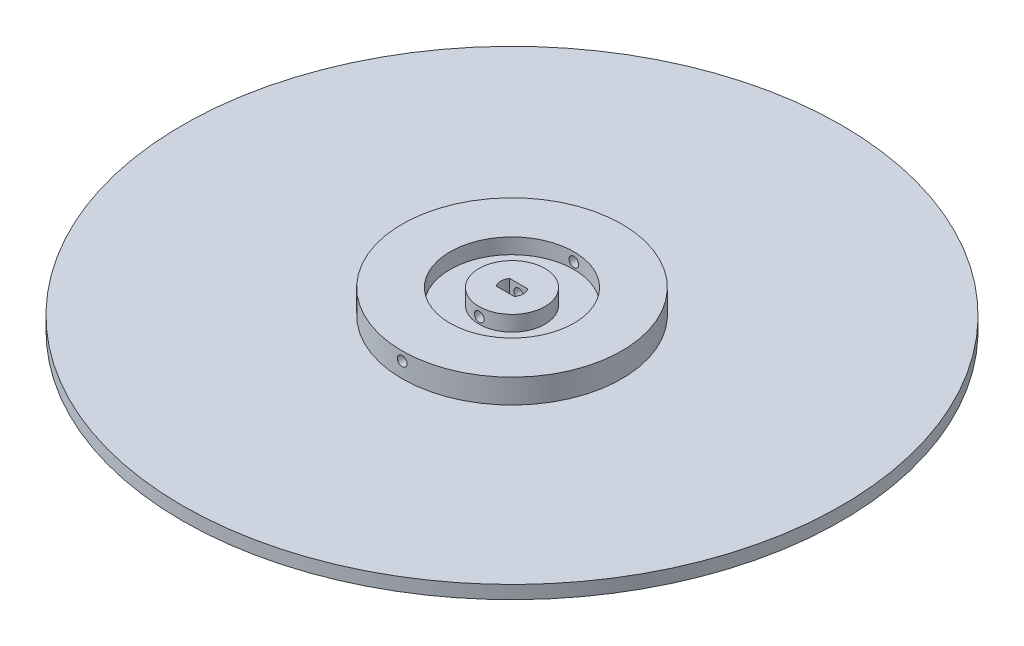
from build123d import *

# Parameters (mm, degrees)
SKETCH1_R               = 75
BOSS_EXTRUDE1_DEPTH     = 3
SKETCH2_R               = 25
SKETCH2_R_2             = 14.1
BOSS_EXTRUDE2_DEPTH     = 5.5
SKETCH3_R               = 7.5
BOSS_EXTRUDE3_DEPTH     = 5.5
CUT_EXTRUDE1_START      = -1
CUT_EXTRUDE1_DEPTH      = 1
SKETCH5_W               = 2.940694944
SKETCH5_H               = 16.18616145
CUT_EXTRUDE2_DEPTH      = 2
CUT_EXTRUDE3_DEPTH      = 2
SKETCH7_R               = 14.1
SKETCH7_R_2             = 7.5
BOSS_EXTRUDE4_DEPTH     = 2
CUT_EXTRUDE4_DEPTH      = 108.486397536
CUT_EXTRUDE4_DEPTH_BACK = 108.486397536
SKETCH9_R               = 1.1
BOSS_EXTRUDE5_DEPTH     = 2
BOSS_EXTRUDE5_2_DEPTH   = 2
SKETCH10_W              = 2.940694944
SKETCH10_H              = 16.18616145
BOSS_EXTRUDE5_3_DEPTH   = 2
BOSS_EXTRUDE5_4_DEPTH   = 2
BOSS_EXTRUDE5_5_DEPTH   = 2
BOSS_EXTRUDE5_6_DEPTH   = 2
BOSS_EXTRUDE5_7_DEPTH   = 2
BOSS_EXTRUDE6_START     = 2
BOSS_EXTRUDE6_DEPTH     = 2


with BuildPart() as part:
    # Sketch1 → Boss-Extrude1 (new body)
    with BuildSketch(Plane(origin=(0, 0, 0), x_dir=(1, 0, 0), z_dir=(0, 1, 0))):
        with Locations(Location((0, 0, 0), (0, 0, 270))):
            Circle(SKETCH1_R)
    extrude(amount=BOSS_EXTRUDE1_DEPTH)

    # Sketch2 → Boss-Extrude2 (add)
    with BuildSketch(Plane(origin=(0, 3, 0), x_dir=(1, 0, 0), z_dir=(0, 1, 0))):
        with Locations(Location((0, 0, 0), (0, 0, 270))):
            Circle(SKETCH2_R)
        with Locations(Location((0, 0, 0), (0, 0, 270))):
            Circle(SKETCH2_R_2, mode=Mode.SUBTRACT)
    extrude(amount=BOSS_EXTRUDE2_DEPTH)

    # Sketch3 → Boss-Extrude3 (add)
    with BuildSketch(Plane(origin=(0, 3, 0), x_dir=(1, 0, 0), z_dir=(0, 1, 0))):
        with Locations(Location((0, 0, 0), (0, 0, 270))):
            Circle(SKETCH3_R)
        with BuildLine():
            Line((-2.043740443, 1.525), (2.043740443, 1.525))
            ThreePointArc((2.043740443, 1.525), (2.55, 0), (2.043740443, -1.525))
            Line((2.043740443, -1.525), (-2.043740443, -1.525))
            ThreePointArc((-2.043740443, -1.525), (-2.55, 0), (-2.043740443, 1.525))
        make_face(mode=Mode.SUBTRACT)
    extrude(amount=BOSS_EXTRUDE3_DEPTH)

    # Sketch4 → Cut-Extrude1 (cut)
    with BuildSketch(Plane(origin=(0, 3, 0), x_dir=(1, 0, 0), z_dir=(0, 1, 0)).offset(CUT_EXTRUDE1_START)):
        with BuildLine():
            Line((-2.043740443, -1.525), (2.043740443, -1.525))
            ThreePointArc((2.043740443, -1.525), (2.55, 0), (2.043740443, 1.525))
            Line((2.043740443, 1.525), (-2.043740443, 1.525))
            ThreePointArc((-2.043740443, 1.525), (-2.55, 0), (-2.043740443, -1.525))
        make_face()
    extrude(amount=CUT_EXTRUDE1_DEPTH, mode=Mode.SUBTRACT)

    # Sketch5 → Cut-Extrude2 (cut)
    # profile 1 of 7: a face of its own
    with BuildSketch(Plane.XZ):
        with BuildLine():
            add(Edge.make_bspline(
                [(45.556454216, -39.351596889), (45.560682842, -39.27749578), (45.56902035, -39.131391935), (45.651254328, -38.926618183), (45.779165618, -38.743734022), (45.960567699, -38.587756331), (46.193013393, -38.461552811), (46.475471587, -38.370137097), (46.807540788, -38.316253676), (47.045118548, -38.308101224), (47.171981399, -38.303747941)],
                knots=[0, 0, 0, 0, 0.822682591, 1.622068704, 2.421372402, 3.291698256, 4.262769824, 5.351717432, 6.585858054, 8, 8, 8, 8], degree=3))
            add(Edge.make_bspline(
                [(47.171981399, -38.303747941), (47.308504537, -38.310238502), (47.572771324, -38.322802232), (47.95144651, -38.421242506), (48.293035335, -38.582747346), (48.592730601, -38.809250049), (48.847806668, -39.088725027), (49.050181148, -39.420573089), (49.205670172, -39.798643086), (49.257808319, -40.073406048), (49.284831481, -40.215815486)],
                knots=[0, 0, 0, 0, 1.045629352, 2.024016691, 2.977370917, 3.924659549, 4.8857932, 5.860639171, 6.891170882, 8, 8, 8, 8], degree=3))
            Line((49.284831481, -40.215815486), (52.181581113, -40.213393185))
            add(Edge.make_bspline(
                [(52.181581113, -40.213393185), (52.157295, -40.044949911), (52.109797345, -39.715516356), (52.002141562, -39.238507613), (51.861149716, -38.792357684), (51.683498498, -38.377820522), (51.473993087, -37.994768426), (51.232641172, -37.642121267), (50.953796904, -37.325141545), (50.645720568, -37.03653847), (50.303337967, -36.784998531), (49.938089439, -36.558142875), (49.539803671, -36.376185839), (49.119603288, -36.219020111), (48.669780935, -36.103585673), (48.195247957, -36.016146058), (47.691915033, -35.9678897), (47.348146942, -35.960118913), (47.171981399, -35.956136738)],
                knots=[0, 0, 0, 0, 1.115186356, 2.181029835, 3.201261054, 4.177832674, 5.132278974, 6.058952456, 6.972557509, 7.894203791, 8.820164286, 9.753083672, 10.707148118, 11.685071394, 12.690189907, 13.746568382, 14.84521858, 16, 16, 16, 16], degree=3))
            add(Edge.make_bspline(
                [(47.171981399, -35.956136738), (46.991603236, -35.961594571), (46.641231848, -35.972196014), (46.13381891, -36.033483927), (45.658582367, -36.118272313), (45.216597218, -36.233924889), (44.80917733, -36.384160208), (44.431615037, -36.559001977), (44.089117887, -36.769076258), (43.780944715, -37.008110236), (43.511445614, -37.271470282), (43.270347308, -37.546025779), (43.069346944, -37.837809631), (42.902946936, -38.142656009), (42.777154778, -38.462871657), (42.682777142, -38.795679243), (42.626987547, -39.143133322), (42.617483, -39.379543465), (42.612673326, -39.499176277)],
                knots=[0, 0, 0, 0, 1.341103628, 2.604995718, 3.79573267, 4.928455379, 5.996521581, 7.020465425, 8.016998586, 8.977140282, 9.91376877, 10.814708741, 11.689610286, 12.542532345, 13.391218095, 14.241938528, 15.110351885, 16, 16, 16, 16], degree=3))
            add(Edge.make_bspline(
                [(42.612673326, -39.499176277), (42.632724557, -39.623036596), (42.671898265, -39.865020148), (42.756034242, -40.216066125), (42.859198725, -40.546280527), (42.98795491, -40.854044867), (43.13228001, -41.14178267), (43.296214938, -41.409482426), (43.482293831, -41.654895716), (43.690196144, -41.877391656), (43.91687636, -42.080100047), (44.16535456, -42.260079625), (44.43562108, -42.416675179), (44.723184717, -42.5562599), (45.030528586, -42.675208472), (45.360309594, -42.765388763), (45.708596805, -42.841331246), (46.188953725, -42.902631964), (46.766287781, -42.976601214), (47.404546694, -43.110651772), (47.962247297, -43.281651855), (48.440423151, -43.489719326), (48.838809649, -43.737081918), (49.158910954, -44.019784233), (49.398713943, -44.343923766), (49.487908829, -44.587099391), (49.53194845, -44.707166392)],
                knots=[0, 0, 0, 0, 0.958803475, 1.87319613, 2.756824075, 3.600172015, 4.420283579, 5.215352031, 5.99611217, 6.770179274, 7.539470245, 8.317169893, 9.110873755, 9.92400681, 10.758605592, 11.625638939, 12.534834498, 13.480923384, 15.325240524, 16.983118335, 18.459257885, 19.77700722, 20.958331076, 22.028303291, 23.026482568, 24, 24, 24, 24], degree=3))
            add(Edge.make_bspline(
                [(49.53194845, -44.707166392), (49.524964661, -44.792407729), (49.511428735, -44.957621821), (49.418166972, -45.190633436), (49.258877611, -45.385988186), (49.048365371, -45.550115049), (48.787734474, -45.679892365), (48.482172614, -45.768723339), (48.135061061, -45.830053591), (47.888925311, -45.835074057), (47.758884199, -45.837726524)],
                knots=[0, 0, 0, 0, 0.87194891, 1.690004542, 2.522861722, 3.423201095, 4.403565794, 5.483709824, 6.670566255, 8, 8, 8, 8], degree=3))
            add(Edge.make_bspline(
                [(47.758884199, -45.837726524), (47.593639377, -45.831382064), (47.277632423, -45.819249197), (46.829489847, -45.722859002), (46.432736503, -45.564218694), (46.086607823, -45.34508062), (45.80416227, -45.057231157), (45.58447792, -44.715034153), (45.433349613, -44.314734441), (45.388423165, -44.02676639), (45.364938565, -43.876235585)],
                knots=[0, 0, 0, 0, 1.152143953, 2.203309587, 3.179823757, 4.120371613, 5.039832004, 5.970450627, 6.93908474, 8, 8, 8, 8], degree=3))
            Line((45.364938565, -43.876235585), (42.380895588, -43.874522176))
            add(Edge.make_bspline(
                [(42.380895588, -43.874522176), (42.400365065, -44.048566586), (42.438257773, -44.387302648), (42.547595311, -44.876487711), (42.69815703, -45.330745319), (42.889453443, -45.752033121), (43.112554195, -46.143412559), (43.382434108, -46.498420668), (43.689048607, -46.821918292), (44.03641864, -47.108257102), (44.414352691, -47.359546799), (44.812498212, -47.584045397), (45.23610101, -47.769898924), (45.683150999, -47.920223179), (46.152366951, -48.042453637), (46.645776032, -48.122489208), (47.160379785, -48.178831927), (47.511604314, -48.183138794), (47.690927033, -48.185337727)],
                knots=[0, 0, 0, 0, 1.102863014, 2.146460644, 3.151764567, 4.112887598, 5.057645288, 5.984114963, 6.915681827, 7.860172158, 8.813865131, 9.772334909, 10.736736965, 11.723595316, 12.741692923, 13.788029659, 14.870646823, 16, 16, 16, 16], degree=3))
            add(Edge.make_bspline(
                [(47.690927033, -48.185337727), (47.874357538, -48.180619377), (48.231663168, -48.171428469), (48.751321371, -48.116585868), (49.241640086, -48.039848002), (49.698340521, -47.92376774), (50.125230671, -47.784728459), (50.516093857, -47.604991368), (50.87951824, -47.403460829), (51.208440247, -47.16736158), (51.500546611, -46.904586319), (51.761337771, -46.623050553), (51.977340792, -46.315602755), (52.155394347, -45.987947563), (52.29484071, -45.639507592), (52.39708588, -45.269926907), (52.460229508, -44.87817707), (52.468444543, -44.609587527), (52.472640377, -44.472405272)],
                knots=[0, 0, 0, 0, 1.293450232, 2.519521215, 3.682182382, 4.789877756, 5.839206083, 6.843347497, 7.818724699, 8.765772378, 9.691367036, 10.58567469, 11.466049476, 12.333544522, 13.209957962, 14.10662061, 15.032955448, 16, 16, 16, 16], degree=3))
            add(Edge.make_bspline(
                [(52.472640377, -44.472405272), (52.452550327, -44.347534329), (52.413295326, -44.103542451), (52.329679662, -43.749191476), (52.224787444, -43.417083282), (52.10285147, -43.104167054), (51.951092086, -42.818017195), (51.790579043, -42.54675565), (51.601731295, -42.301348492), (51.396427808, -42.075422475), (51.167264912, -41.873459192), (50.92112969, -41.689278522), (50.65010132, -41.534461414), (50.363895957, -41.392059857), (50.055473936, -41.275585663), (49.725076136, -41.184380932), (49.376682265, -41.108773986), (48.896597699, -41.046769567), (48.319883933, -40.97764348), (47.683283425, -40.84271698), (47.125017106, -40.684009698), (46.648166738, -40.487675331), (46.250398553, -40.258745769), (45.931845887, -39.99592366), (45.691137552, -39.694407804), (45.600733587, -39.465911369), (45.556454216, -39.353995058)],
                knots=[0, 0, 0, 0, 0.972154384, 1.8995434, 2.795835943, 3.648415207, 4.476876676, 5.283299116, 6.068580653, 6.852943988, 7.626689939, 8.413565797, 9.211866014, 10.02258961, 10.869416608, 11.741470962, 12.655931692, 13.607499397, 15.461398818, 17.119493729, 18.604856779, 19.91769616, 21.074407654, 22.119379587, 23.078882352, 24, 24, 24, 24], degree=3))
            Line((45.556454216, -39.353995058), (45.556454216, -39.351596889))
        make_face()
    # profile 2 of 7: a face of its own
    with BuildSketch(Plane.XZ):
        with BuildLine():
            add(Edge.make_bspline(
                [(34.660767823, -35.953050793), (34.438393658, -35.962952784), (34.003103516, -35.982335607), (33.366749512, -36.069828287), (32.761809009, -36.205046455), (32.186364775, -36.39103004), (31.640748685, -36.627827507), (31.129366822, -36.922517781), (30.643641729, -37.258999279), (30.195401867, -37.647324376), (29.787638981, -38.076481254), (29.426210058, -38.540235161), (29.123353949, -39.042602508), (28.867064457, -39.575136508), (28.671243127, -40.14515828), (28.521748915, -40.745262865), (28.428989309, -41.380757891), (28.40801263, -41.815602974), (28.397269702, -42.03830313)],
                knots=[0, 0, 0, 0, 1.094407341, 2.142266515, 3.154669814, 4.139643995, 5.112565903, 6.074298334, 7.038108748, 8.014806402, 8.98561699, 9.945948246, 10.900506465, 11.86552697, 12.847371343, 13.859508592, 14.903775648, 16, 16, 16, 16], degree=3))
            add(Edge.make_bspline(
                [(28.397269702, -42.03830313), (28.406555667, -42.262091574), (28.424733925, -42.700181117), (28.520939784, -43.339535779), (28.659885301, -43.946484945), (28.856531406, -44.519557712), (29.103699895, -45.05939774), (29.404881519, -45.565966411), (29.759435332, -46.036826059), (30.160040013, -46.472498482), (30.604567942, -46.862876641), (31.081297944, -47.20840326), (31.591567786, -47.499650408), (32.131693483, -47.741376905), (32.70241447, -47.933899038), (33.30559319, -48.072408548), (33.939524593, -48.159422815), (34.37310977, -48.176598401), (34.593727692, -48.185337727)],
                knots=[0, 0, 0, 0, 1.100547231, 2.15443758, 3.173662499, 4.15826398, 5.127795646, 6.088057164, 7.049945409, 8.020863923, 8.992890491, 9.953939049, 10.910912036, 11.876257929, 12.859231161, 13.867445446, 14.914908125, 16, 16, 16, 16], degree=3))
            add(Edge.make_bspline(
                [(34.593727692, -48.185337727), (34.814364307, -48.176725349), (35.245946556, -48.159878873), (35.877612483, -48.071648795), (36.478989124, -47.934222704), (37.048757865, -47.740542147), (37.590504885, -47.503488715), (38.099832542, -47.211204552), (38.576867791, -46.866159647), (39.021273138, -46.474634196), (39.424000587, -46.041222669), (39.780332324, -45.571731901), (40.080013281, -45.066240039), (40.327107579, -44.528311295), (40.528494899, -43.959552989), (40.66624124, -43.354911404), (40.76280131, -42.718754373), (40.780926229, -42.28269495), (40.790185682, -42.059925865)],
                knots=[0, 0, 0, 0, 1.087498939, 2.127231865, 3.137682676, 4.122836441, 5.0882594, 6.047355244, 7.010535699, 7.984718518, 8.961237208, 9.921205001, 10.883596671, 11.850671474, 12.834321537, 13.850868483, 14.902076099, 16, 16, 16, 16], degree=3))
            add(Edge.make_bspline(
                [(40.790185682, -42.059925865), (40.780558741, -41.836186194), (40.761719262, -41.398338027), (40.670663689, -40.760661578), (40.532526882, -40.156316249), (40.340997151, -39.585708163), (40.096044541, -39.048190911), (39.798783325, -38.545900566), (39.448874018, -38.079645587), (39.055227732, -37.647584604), (38.617952205, -37.259679224), (38.143963296, -36.920649473), (37.640639115, -36.629840803), (37.104878758, -36.389505891), (36.536806587, -36.20526434), (35.938159857, -36.069937336), (35.308747229, -35.981679307), (34.87820069, -35.964764376), (34.658595896, -35.956136738)],
                knots=[0, 0, 0, 0, 1.108980763, 2.170223957, 3.186164223, 4.176670014, 5.146868513, 6.107497549, 7.062475138, 8.030175855, 8.998629271, 9.952802622, 10.91268638, 11.874033046, 12.856479537, 13.866304889, 14.911686352, 16, 16, 16, 16], degree=3))
            Line((34.658595896, -35.956136738), (34.660767823, -35.953050793))
        make_face()
        with BuildLine():
            add(Edge.make_bspline(
                [(34.618077401, -38.498358587), (34.72644098, -38.503872747), (34.939833305, -38.514731372), (35.253042764, -38.559868575), (35.551630364, -38.63869814), (35.83579671, -38.74266984), (36.104849901, -38.876372366), (36.355681959, -39.042765578), (36.594321007, -39.233272653), (36.814139617, -39.45457256), (37.014471674, -39.699759301), (37.188787255, -39.971651423), (37.335881911, -40.265348878), (37.460700111, -40.580330568), (37.560112168, -40.918218866), (37.628460528, -41.279477246), (37.677343602, -41.662227894), (37.684954473, -41.924879381), (37.688867725, -42.059925865)],
                knots=[0, 0, 0, 0, 0.987775126, 1.945151991, 2.875282061, 3.79490883, 4.696433315, 5.604032012, 6.530942973, 7.47239331, 8.438863667, 9.408965677, 10.406941125, 11.425493753, 12.490624871, 13.608628784, 14.770438052, 16, 16, 16, 16], degree=3))
            add(Edge.make_bspline(
                [(37.688867725, -42.059925865), (37.684738279, -42.195959152), (37.676674382, -42.461602198), (37.630595994, -42.848213127), (37.554368662, -43.210745221), (37.462063825, -43.553937074), (37.33300225, -43.870669611), (37.186228794, -44.167660115), (37.008111045, -44.438746543), (36.80393909, -44.684059474), (36.583113192, -44.907253914), (36.34289874, -45.099618274), (36.089273861, -45.265115986), (35.817982483, -45.398138475), (35.533135894, -45.502892945), (35.233514746, -45.581750557), (34.91841755, -45.62745456), (34.703011902, -45.635799311), (34.593727692, -45.640032949)],
                knots=[0, 0, 0, 0, 1.230112969, 2.402139683, 3.514021852, 4.577947043, 5.609992483, 6.600867014, 7.569136768, 8.534627867, 9.482544998, 10.402860689, 11.311805834, 12.215251878, 13.128335207, 14.051847101, 15.011621323, 16, 16, 16, 16], degree=3))
            add(Edge.make_bspline(
                [(34.593727692, -45.640032949), (34.483403757, -45.635870216), (34.266946821, -45.627702881), (33.949944036, -45.58128534), (33.649018462, -45.503476239), (33.36330775, -45.39807829), (33.092011113, -45.265123041), (32.838335303, -45.099650758), (32.598334759, -44.907113149), (32.377136072, -44.685074093), (32.176492502, -44.437681233), (31.998214262, -44.167711305), (31.850572418, -43.871350326), (31.726545538, -43.553136425), (31.63182503, -43.211257883), (31.561150579, -42.847749937), (31.51353834, -42.461672917), (31.505693758, -42.195983102), (31.501676621, -42.059925865)],
                knots=[0, 0, 0, 0, 0.997226525, 1.956570881, 2.888677024, 3.801351401, 4.704392808, 5.612930854, 6.532834354, 7.48032693, 8.439490755, 9.40732684, 10.397757578, 11.425935724, 12.489384404, 13.598936189, 14.770437975, 16, 16, 16, 16], degree=3))
            add(Edge.make_bspline(
                [(31.501676621, -42.059925865), (31.506907745, -41.924895961), (31.517079876, -41.662324917), (31.564906845, -41.27943903), (31.633819904, -40.918321932), (31.732158919, -40.579611258), (31.861308169, -40.265446491), (32.010427399, -39.970417486), (32.192201062, -39.700771833), (32.394697687, -39.453195149), (32.621044553, -39.234245784), (32.862569967, -39.042565804), (33.116670647, -38.876271862), (33.388033536, -38.743417419), (33.673726304, -38.637993356), (33.974656718, -38.560186702), (34.290639052, -38.513936295), (34.506058975, -38.505647012), (34.615350427, -38.501441516)],
                knots=[0, 0, 0, 0, 1.223343949, 2.378841185, 3.490771058, 4.550115391, 5.566604938, 6.563398565, 7.538450654, 8.505577725, 9.455192627, 10.384349465, 11.294834767, 12.199811651, 13.11444215, 14.048546063, 15.009946569, 16, 16, 16, 16], degree=3))
            Line((34.615350427, -38.501441516), (34.618077401, -38.498358587))
        make_face(mode=Mode.SUBTRACT)
    # profile 3 of 7: a face of its own
    with BuildSketch(Plane.XZ):
        with Locations((24.316749248, -39.894566443)):
            Rectangle(SKETCH5_W, SKETCH5_H)
    # profile 4 of 7: a face of its own
    with BuildSketch(Plane.XZ):
        with BuildLine():
            add(Edge.make_bspline(
                [(16.717897936, -37.862074624), (16.612289645, -37.712046105), (16.404701412, -37.417143546), (16.037465426, -37.028878428), (15.630799875, -36.700321704), (15.186356756, -36.429843565), (14.70224139, -36.21816432), (14.179149248, -36.066559723), (13.616511004, -35.977409238), (13.228726234, -35.963352045), (13.029683211, -35.956136738)],
                knots=[0, 0, 0, 0, 1.013396386, 1.991975859, 2.943284186, 3.896175292, 4.859736797, 5.855974001, 6.899509605, 8, 8, 8, 8], degree=3))
            add(Edge.make_bspline(
                [(13.029683211, -35.956136738), (12.823459782, -35.964821391), (12.419563654, -35.981830601), (11.829657281, -36.069103742), (11.27214931, -36.208065812), (10.745980739, -36.395743969), (10.255088531, -36.639492018), (9.794135972, -36.930961935), (9.367032816, -37.275803939), (8.974271107, -37.668096948), (8.624794349, -38.104268961), (8.311048266, -38.571784467), (8.054003839, -39.078925361), (7.836206594, -39.614672912), (7.665276949, -40.184507477), (7.544987164, -40.787626876), (7.460624398, -41.423359943), (7.448136364, -41.858860551), (7.441750756, -42.0815486)],
                knots=[0, 0, 0, 0, 1.064571418, 2.085002049, 3.070830742, 4.025481884, 4.961709172, 5.893281139, 6.834275728, 7.788571937, 8.751980652, 9.714275193, 10.688581753, 11.680178247, 12.695477778, 13.753145176, 14.851097552, 16, 16, 16, 16], degree=3))
            add(Edge.make_bspline(
                [(7.441750756, -42.0815486), (7.449383289, -42.305263942), (7.46427472, -42.74174311), (7.548146194, -43.378473604), (7.66772495, -43.983274645), (7.843424963, -44.552760943), (8.056796388, -45.091136236), (8.326892659, -45.590372185), (8.635176213, -46.060052648), (8.990529784, -46.490490188), (9.381013403, -46.882103882), (9.811523568, -47.21772874), (10.265294276, -47.513166058), (10.75633091, -47.746185013), (11.274318846, -47.938126071), (11.826144789, -48.070778963), (12.407055508, -48.160056944), (12.804884046, -48.176791276), (13.008060476, -48.185337727)],
                knots=[0, 0, 0, 0, 1.159583679, 2.262402367, 3.324757527, 4.351210366, 5.347201784, 6.321334297, 7.287893891, 8.254807029, 9.209566576, 10.148078831, 11.07927908, 12.010173415, 12.959022934, 13.937575024, 14.946691596, 16, 16, 16, 16], degree=3))
            add(Edge.make_bspline(
                [(13.008060476, -48.185337727), (13.207275572, -48.176804143), (13.595969761, -48.160154027), (14.157247925, -48.05456924), (14.681903452, -47.898509978), (15.167897769, -47.680354756), (15.61794581, -47.403609318), (16.026030558, -47.063619508), (16.399661964, -46.668527556), (16.608397935, -46.367863461), (16.714815007, -46.214579901)],
                knots=[0, 0, 0, 0, 1.090172401, 2.127066098, 3.116544778, 4.080182682, 5.034230758, 5.999005135, 6.979859513, 8, 8, 8, 8], degree=3))
            Line((16.714815007, -46.214579901), (16.717897936, -47.987644152))
            Line((16.717897936, -47.987644152), (19.65859288, -47.987644152))
            Line((19.65859288, -47.987644152), (19.65859288, -36.150744367))
            Line((19.65859288, -36.150744367), (16.717897936, -36.150744367))
            Line((16.717897936, -36.150744367), (16.717897936, -37.862074624))
        make_face()
        with BuildLine():
            add(Edge.make_bspline(
                [(10.546157676, -42.079883456), (10.549402051, -41.95161018), (10.555790282, -41.69903785), (10.597673004, -41.33036508), (10.656959834, -40.978390012), (10.747741087, -40.647015822), (10.861650951, -40.333529142), (11.000869481, -40.040203266), (11.16287767, -39.76420253), (11.350389409, -39.509780942), (11.55942354, -39.276627055), (11.7925027, -39.075183507), (12.045657587, -38.903519005), (12.318777464, -38.760376545), (12.614475097, -38.648743975), (12.93189136, -38.570011402), (13.268835051, -38.51563798), (13.501048276, -38.506241653), (13.619674974, -38.501441516)],
                knots=[0, 0, 0, 0, 1.159479996, 2.283036439, 3.351245904, 4.38318951, 5.384449131, 6.362949879, 7.314423177, 8.27324457, 9.215613089, 10.139456016, 11.050834424, 11.975146188, 12.920819019, 13.900647148, 14.927540428, 16, 16, 16, 16], degree=3))
            add(Edge.make_bspline(
                [(13.619674974, -38.501441516), (13.740344375, -38.50627778), (13.975605573, -38.515706727), (14.317148939, -38.569169829), (14.638255799, -38.652361914), (14.938276961, -38.767142388), (15.219081296, -38.909248736), (15.477436933, -39.083599357), (15.713790839, -39.290024879), (15.928665886, -39.523586473), (16.119543926, -39.781895498), (16.291327444, -40.056132858), (16.432672571, -40.352195477), (16.551070887, -40.663895673), (16.638946936, -40.994624166), (16.708565619, -41.340884086), (16.747927032, -41.705862482), (16.754642048, -41.954814185), (16.758060476, -42.0815486)],
                knots=[0, 0, 0, 0, 1.08305709, 2.111565199, 3.09548074, 4.054790103, 4.988753887, 5.913945707, 6.844061855, 7.798821109, 8.756125737, 9.722882715, 10.698212935, 11.695360287, 12.710835032, 13.765533873, 14.862495207, 16, 16, 16, 16], degree=3))
            add(Edge.make_bspline(
                [(16.758060476, -42.0815486), (16.754643432, -42.207254497), (16.747931986, -42.454154549), (16.708564206, -42.816052557), (16.638982266, -43.159249212), (16.550970902, -43.486835412), (16.433002838, -43.795717249), (16.289921034, -44.088064246), (16.12323235, -44.363654954), (15.93237205, -44.61965441), (15.719003034, -44.852499483), (15.483626562, -45.057938575), (15.22584354, -45.231370098), (14.947685856, -45.374439269), (14.650644237, -45.489074755), (14.332634395, -45.57232304), (13.9941536, -45.625771163), (13.760938751, -45.635197278), (13.641297709, -45.640032949)],
                knots=[0, 0, 0, 0, 1.136466223, 2.232143243, 3.285370443, 4.29924552, 5.294928766, 6.268973701, 7.237891227, 8.202148315, 9.150690028, 10.087561178, 11.019472237, 11.951940882, 12.909526701, 13.891587509, 14.918367896, 16, 16, 16, 16], degree=3))
            add(Edge.make_bspline(
                [(13.641297709, -45.640032949), (13.522674071, -45.635224369), (13.290466836, -45.625811515), (12.953480335, -45.571556202), (12.635280383, -45.49216992), (12.337323661, -45.381219459), (12.061369139, -45.23778084), (11.804930489, -45.067526676), (11.572996135, -44.863770869), (11.359176692, -44.63627941), (11.171453338, -44.380601101), (11.004521912, -44.107402907), (10.864986559, -43.814053649), (10.750558082, -43.503841284), (10.660600973, -43.174148319), (10.597157013, -42.825839125), (10.55579305, -42.459373423), (10.549416621, -42.209339204), (10.546157676, -42.0815486)],
                knots=[0, 0, 0, 0, 1.073335271, 2.101067045, 3.081695238, 4.036857533, 4.970190179, 5.89003492, 6.814632196, 7.757217895, 8.709331381, 9.679146681, 10.65003528, 11.643370028, 12.66716744, 13.737912066, 14.843863919, 16, 16, 16, 16], degree=3))
            Line((10.546157676, -42.0815486), (10.546157676, -42.079883456))
        make_face(mode=Mode.SUBTRACT)
    # profile 5 of 7: a face of its own
    with BuildSketch(Plane.XZ):
        with BuildLine():
            add(Edge.make_bspline(
                [(0.309334231, -44.629010221), (0.310918226, -44.772586273), (0.31398838, -45.050870392), (0.360045014, -45.453507024), (0.425261195, -45.829192031), (0.522684608, -46.176958469), (0.64068586, -46.499237026), (0.79005037, -46.792773292), (0.968242852, -47.056632969), (1.167972578, -47.296204514), (1.398022017, -47.506219403), (1.653791837, -47.688652757), (1.938660786, -47.839434894), (2.246286213, -47.96738728), (2.581597786, -48.066715125), (2.944352009, -48.131383973), (3.332296103, -48.176900278), (3.599968464, -48.182465908), (3.738085188, -48.185337727)],
                knots=[0, 0, 0, 0, 1.217093266, 2.359012688, 3.433090874, 4.448019493, 5.418066963, 6.339854432, 7.233662951, 8.11371181, 8.979077593, 9.868437573, 10.771077399, 11.706907427, 12.690657528, 13.730383992, 14.828896914, 16, 16, 16, 16], degree=3))
            add(Edge.make_bspline(
                [(3.738085188, -48.185337727), (3.946538553, -48.180258744), (4.349343723, -48.170444365), (4.927534276, -48.071182802), (5.460328403, -47.919413158), (5.780827324, -47.759817091), (5.937426209, -47.681836903)],
                knots=[0, 0, 0, 0, 1.096374287, 2.118580479, 3.080720151, 4, 4, 4, 4], degree=3))
            Line((5.937426209, -47.681836903), (5.940285913, -45.209810511))
            add(Edge.make_bspline(
                [(5.940285913, -45.209810511), (5.827473726, -45.271813722), (5.60001209, -45.396829931), (5.233818857, -45.528730731), (4.860613669, -45.619915528), (4.608638532, -45.633433114), (4.485614018, -45.640032949)],
                knots=[0, 0, 0, 0, 1.006159724, 2.028705809, 3.037533975, 4, 4, 4, 4], degree=3))
            add(Edge.make_bspline(
                [(4.485614018, -45.640032949), (4.380253597, -45.63754091), (4.183846695, -45.632895394), (3.912124092, -45.572226716), (3.688467264, -45.467125511), (3.511819656, -45.315164715), (3.385628523, -45.114634531), (3.30638625, -44.869549119), (3.251470182, -44.582951229), (3.250530611, -44.375929534), (3.250029175, -44.265444811)],
                knots=[0, 0, 0, 0, 1.174621131, 2.189661875, 3.084285769, 3.907275649, 4.755491957, 5.693527848, 6.769066505, 8, 8, 8, 8], degree=3))
            Line((3.250029175, -44.265444811), (3.250029175, -38.498358587))
            Line((3.250029175, -38.498358587), (5.918934669, -38.498358587))
            Line((5.918934669, -38.498358587), (5.918934669, -36.150744367))
            Line((5.918934669, -36.150744367), (3.250029175, -36.150744367))
            Line((3.250029175, -36.150744367), (3.250029175, -33.225623946))
            Line((3.250029175, -33.225623946), (0.309334231, -33.225623946))
            Line((0.309334231, -33.225623946), (0.309334231, -36.150744367))
            Line((0.309334231, -36.150744367), (-1.09984787, -36.150744367))
            Line((-1.09984787, -36.150744367), (-1.09984787, -38.498358587))
            Line((-1.09984787, -38.498358587), (0.309334231, -38.498358587))
            Line((0.309334231, -38.498358587), (0.309334231, -44.629010221))
        make_face()
    # profile 6 of 7: a face of its own
    with BuildSketch(Plane.XZ):
        with BuildLine():
            add(Edge.make_bspline(
                [(-7.993795918, -44.629010221), (-7.992211923, -44.772586273), (-7.989141768, -45.050870392), (-7.943085134, -45.453507024), (-7.877868953, -45.829192031), (-7.78044554, -46.176958469), (-7.662444288, -46.499237026), (-7.513079778, -46.792773292), (-7.334887296, -47.056632969), (-7.13515757, -47.296204514), (-6.905108132, -47.506219403), (-6.649338311, -47.688652757), (-6.364469363, -47.839434894), (-6.056843936, -47.96738728), (-5.721532362, -48.066715125), (-5.358778139, -48.131383973), (-4.970834045, -48.176900278), (-4.703161684, -48.182465908), (-4.56504496, -48.185337727)],
                knots=[0, 0, 0, 0, 1.217093266, 2.359012688, 3.433090874, 4.448019493, 5.418066963, 6.339854432, 7.233662951, 8.11371181, 8.979077593, 9.868437573, 10.771077399, 11.706907427, 12.690657528, 13.730383992, 14.828896914, 16, 16, 16, 16], degree=3))
            add(Edge.make_bspline(
                [(-4.56504496, -48.185337727), (-4.356591595, -48.180258744), (-3.953786426, -48.170444365), (-3.375595873, -48.071182802), (-2.842801745, -47.919413158), (-2.522302824, -47.759817091), (-2.365703939, -47.681836903)],
                knots=[0, 0, 0, 0, 1.096374287, 2.118580479, 3.080720151, 4, 4, 4, 4], degree=3))
            Line((-2.365703939, -47.681836903), (-2.362844236, -45.209810511))
            add(Edge.make_bspline(
                [(-2.362844236, -45.209810511), (-2.475656422, -45.271813722), (-2.703118058, -45.396829931), (-3.069311291, -45.528730731), (-3.442516479, -45.619915528), (-3.694491617, -45.633433114), (-3.81751613, -45.640032949)],
                knots=[0, 0, 0, 0, 1.006159724, 2.028705809, 3.037533975, 4, 4, 4, 4], degree=3))
            add(Edge.make_bspline(
                [(-3.81751613, -45.640032949), (-3.922876551, -45.63754091), (-4.119283453, -45.632895394), (-4.391006057, -45.572226716), (-4.614662885, -45.467125511), (-4.791310492, -45.315164715), (-4.917501625, -45.114634531), (-4.996743898, -44.869549119), (-5.051659966, -44.582951229), (-5.052599537, -44.375929534), (-5.053100973, -44.265444811)],
                knots=[0, 0, 0, 0, 1.174621131, 2.189661875, 3.084285769, 3.907275649, 4.755491957, 5.693527848, 6.769066505, 8, 8, 8, 8], degree=3))
            Line((-5.053100973, -44.265444811), (-5.053100973, -38.498358587))
            Line((-5.053100973, -38.498358587), (-2.38419548, -38.498358587))
            Line((-2.38419548, -38.498358587), (-2.38419548, -36.150744367))
            Line((-2.38419548, -36.150744367), (-5.053100973, -36.150744367))
            Line((-5.053100973, -36.150744367), (-5.053100973, -33.225623946))
            Line((-5.053100973, -33.225623946), (-7.993795918, -33.225623946))
            Line((-7.993795918, -33.225623946), (-7.993795918, -36.150744367))
            Line((-7.993795918, -36.150744367), (-9.402978018, -36.150744367))
            Line((-9.402978018, -36.150744367), (-9.402978018, -38.498358587))
            Line((-9.402978018, -38.498358587), (-7.993795918, -38.498358587))
            Line((-7.993795918, -38.498358587), (-7.993795918, -44.629010221))
        make_face()
    # profile 7 of 7: a face of its own
    with BuildSketch(Plane.XZ):
        Polygon((-19.274308468, -32.987647168), (-24.600053198, -47.987647168), (-21.468515297, -47.987647168), (-20.552487203, -45.219937119), (-14.438532254, -45.219937119), (-13.52250416, -47.987647168), (-10.390830514, -47.987647168), (-15.69540801, -32.987647168), align=None)
        Polygon((-15.333257368, -42.674629325), (-19.657762089, -42.674629325), (-17.484858239, -36.126035687), align=None, mode=Mode.SUBTRACT)
    extrude(amount=-CUT_EXTRUDE2_DEPTH, mode=Mode.SUBTRACT)

    # Sketch6 → Cut-Extrude3 (cut)
    with BuildSketch(Plane.XZ):
        with BuildLine():
            ThreePointArc((-45.613873864, -37.939974312), (-44.60144251, -38.455250461), (-43.492232392, -38.700565917))
            ThreePointArc((-43.492232392, -38.700565917), (-43.065024412, -40.502826676), (-43.540537589, -42.292948939))
            ThreePointArc((-43.540537589, -42.292948939), (-44.712097682, -42.574904698), (-45.766831286, -43.157647459))
            ThreePointArc((-45.766831286, -43.157647459), (-45.976101991, -44.210659621), (-44.949140514, -44.523675541))
            ThreePointArc((-44.949140514, -44.523675541), (-43.937250748, -43.869358185), (-43.135276099, -42.96997575))
            ThreePointArc((-43.135276099, -42.96997575), (-41.288622845, -43.419881553), (-39.890845193, -44.707810553))
            ThreePointArc((-39.890845193, -44.707810553), (-40.339217538, -46.089074836), (-40.324329253, -47.541213644))
            ThreePointArc((-40.324329253, -47.541213644), (-39.4869178, -48.245467091), (-38.649506347, -47.541213644))
            ThreePointArc((-38.649506347, -47.541213644), (-38.634618062, -46.089074836), (-39.082990408, -44.707810553))
            ThreePointArc((-39.082990408, -44.707810553), (-37.68602228, -43.420315289), (-35.84039613, -42.969950858))
            ThreePointArc((-35.84039613, -42.969950858), (-35.035897845, -43.871503863), (-34.020513987, -44.526493123))
            ThreePointArc((-34.020513987, -44.526493123), (-32.994532212, -44.21283071), (-33.20321669, -43.160465041))
            ThreePointArc((-33.20321669, -43.160465041), (-34.260441426, -42.57540849), (-35.435226816, -42.292752166))
            ThreePointArc((-35.435226816, -42.292752166), (-35.910631202, -40.502812286), (-35.483513419, -38.700740005))
            ThreePointArc((-35.483513419, -38.700740005), (-34.368594859, -38.453886902), (-33.351708514, -37.934346708))
            ThreePointArc((-33.351708514, -37.934346708), (-33.104570203, -36.791812969), (-34.231982487, -36.482940451))
            ThreePointArc((-34.231982487, -36.482940451), (-35.162673446, -37.144600627), (-35.8968531, -38.019220595))
            ThreePointArc((-35.8968531, -38.019220595), (-37.710853609, -37.555096847), (-39.082990408, -36.28102883))
            ThreePointArc((-39.082990408, -36.28102883), (-38.634618062, -34.899764547), (-38.649506347, -33.447625739))
            ThreePointArc((-38.649506347, -33.447625739), (-39.4869178, -32.743372293), (-40.324329253, -33.447625739))
            ThreePointArc((-40.324329253, -33.447625739), (-40.339217538, -34.899764547), (-39.890845193, -36.28102883))
            ThreePointArc((-39.890845193, -36.28102883), (-41.263780148, -37.555532156), (-43.078800793, -38.019222973))
            ThreePointArc((-43.078800793, -38.019222973), (-43.808607086, -37.148642975), (-44.733176098, -36.488568054))
            ThreePointArc((-44.733176098, -36.488568054), (-45.862477019, -36.796222468), (-45.613873864, -37.939974312))
        make_face()
        with BuildLine():
            ThreePointArc((-36.222036136, -42.281808743), (-38.04726387, -42.819878029), (-39.4869178, -44.064213756))
            ThreePointArc((-39.4869178, -44.064213756), (-40.927347181, -42.819454783), (-42.753561576, -42.281679101))
            ThreePointArc((-42.753561576, -42.281679101), (-42.36490602, -40.496743802), (-42.717779405, -38.704391288))
            ThreePointArc((-42.717779405, -38.704391288), (-40.911612334, -38.160757686), (-39.4869178, -36.924625628))
            ThreePointArc((-39.4869178, -36.924625628), (-38.06299628, -38.160331762), (-36.257815525, -38.704247735))
            ThreePointArc((-36.257815525, -38.704247735), (-36.61074947, -40.496736867), (-36.222036136, -42.281808743))
        make_face(mode=Mode.SUBTRACT)
    extrude(amount=-CUT_EXTRUDE3_DEPTH, mode=Mode.SUBTRACT)

    # Sketch7 → Boss-Extrude4 (add)
    with BuildSketch(Plane(origin=(0, 3, 0), x_dir=(1, 0, 0), z_dir=(0, 1, 0))):
        with Locations(Location((0, 0, 0), (0, 0, 270))):
            Circle(SKETCH7_R)
        with Locations(Location((0, 0, 0), (0, 0, 270))):
            Circle(SKETCH7_R_2, mode=Mode.SUBTRACT)
    extrude(amount=BOSS_EXTRUDE4_DEPTH)

    # Sketch9 → Cut-Extrude4 (cut, two sides: drawn at the far end of the back side and taken through both)
    with BuildSketch(Plane.XY.offset(-1.525).offset(-CUT_EXTRUDE4_DEPTH_BACK)):
        with Locations((0, 6.5)):
            Circle(SKETCH9_R)
    extrude(amount=CUT_EXTRUDE4_DEPTH + CUT_EXTRUDE4_DEPTH_BACK, mode=Mode.SUBTRACT)


with BuildPart() as body_2:
    # Sketch10 → Boss-Extrude5 (new body)
    with BuildSketch(Plane.XZ.offset(-2)):
        with BuildLine():
            Line((45.556454216, -39.353995058), (45.556454216, -39.351596889))
            add(Edge.make_bspline(
                [(45.556454216, -39.351596889), (45.560682842, -39.27749578), (45.56902035, -39.131391935), (45.651254328, -38.926618183), (45.779165618, -38.743734022), (45.960567699, -38.587756331), (46.193013393, -38.461552811), (46.475471587, -38.370137097), (46.807540788, -38.316253676), (47.045118548, -38.308101224), (47.171981399, -38.303747941)],
                knots=[0, 0, 0, 0, 0.102835324, 0.202758588, 0.30267155, 0.411462282, 0.532846228, 0.668964679, 0.823232257, 1, 1, 1, 1], degree=3))
            add(Edge.make_bspline(
                [(47.171981399, -38.303747941), (47.308504537, -38.310238502), (47.572771324, -38.322802232), (47.95144651, -38.421242506), (48.293035335, -38.582747346), (48.592730601, -38.809250049), (48.847806668, -39.088725027), (49.050181148, -39.420573089), (49.205670172, -39.798643086), (49.257808319, -40.073406048), (49.284831481, -40.215815486)],
                knots=[0, 0, 0, 0, 0.130703669, 0.253002086, 0.372171365, 0.490582444, 0.61072415, 0.732579896, 0.86139636, 1, 1, 1, 1], degree=3))
            Line((49.284831481, -40.215815486), (52.181581113, -40.213393185))
            add(Edge.make_bspline(
                [(52.181581113, -40.213393185), (52.157295, -40.044949911), (52.109797345, -39.715516356), (52.002141562, -39.238507613), (51.861149716, -38.792357684), (51.683498498, -38.377820522), (51.473993087, -37.994768426), (51.232641172, -37.642121267), (50.953796904, -37.325141545), (50.645720568, -37.03653847), (50.303337967, -36.784998531), (49.938089439, -36.558142875), (49.539803671, -36.376185839), (49.119603288, -36.219020111), (48.669780935, -36.103585673), (48.195247957, -36.016146058), (47.691915033, -35.9678897), (47.348146942, -35.960118913), (47.171981399, -35.956136738)],
                knots=[0, 0, 0, 0, 0.069699147, 0.136314365, 0.200078816, 0.261114542, 0.320767436, 0.378684528, 0.435784844, 0.493387737, 0.551260268, 0.609567729, 0.669196757, 0.730316962, 0.793136869, 0.859160524, 0.927826161, 1, 1, 1, 1], degree=3))
            add(Edge.make_bspline(
                [(47.171981399, -35.956136738), (46.991603236, -35.961594571), (46.641231848, -35.972196014), (46.13381891, -36.033483927), (45.658582367, -36.118272313), (45.216597218, -36.233924889), (44.80917733, -36.384160208), (44.431615037, -36.559001977), (44.089117887, -36.769076258), (43.780944715, -37.008110236), (43.511445614, -37.271470282), (43.270347308, -37.546025779), (43.069346944, -37.837809631), (42.902946936, -38.142656009), (42.777154778, -38.462871657), (42.682777142, -38.795679243), (42.626987547, -39.143133322), (42.617483, -39.379543465), (42.612673326, -39.499176277)],
                knots=[0, 0, 0, 0, 0.083818977, 0.162812232, 0.237233292, 0.308028461, 0.374782599, 0.438779089, 0.501062412, 0.561071268, 0.619610548, 0.675919296, 0.730600643, 0.783908272, 0.836951131, 0.890121158, 0.944396993, 1, 1, 1, 1], degree=3))
            add(Edge.make_bspline(
                [(42.612673326, -39.499176277), (42.632724557, -39.623036596), (42.671898265, -39.865020148), (42.756034242, -40.216066125), (42.859198725, -40.546280527), (42.98795491, -40.854044867), (43.13228001, -41.14178267), (43.296214938, -41.409482426), (43.482293831, -41.654895716), (43.690196144, -41.877391656), (43.91687636, -42.080100047), (44.16535456, -42.260079625), (44.43562108, -42.416675179), (44.723184717, -42.5562599), (45.030528586, -42.675208472), (45.360309594, -42.765388763), (45.708596805, -42.841331246), (46.188953725, -42.902631964), (46.766287781, -42.976601214), (47.404546694, -43.110651772), (47.962247297, -43.281651855), (48.440423151, -43.489719326), (48.838809649, -43.737081918), (49.158910954, -44.019784233), (49.398713943, -44.343923766), (49.487908829, -44.587099391), (49.53194845, -44.707166392)],
                knots=[0, 0, 0, 0, 0.039950145, 0.078049839, 0.11486767, 0.150007167, 0.184178482, 0.217306335, 0.249838007, 0.282090803, 0.314144594, 0.346548746, 0.37961974, 0.413500284, 0.448275233, 0.484401622, 0.522284771, 0.561705141, 0.638551688, 0.707629931, 0.769135745, 0.824041967, 0.873263795, 0.91784597, 0.959436774, 1, 1, 1, 1], degree=3))
            add(Edge.make_bspline(
                [(49.53194845, -44.707166392), (49.524964661, -44.792407729), (49.511428735, -44.957621821), (49.418166972, -45.190633436), (49.258877611, -45.385988186), (49.048365371, -45.550115049), (48.787734474, -45.679892365), (48.482172614, -45.768723339), (48.135061061, -45.830053591), (47.888925311, -45.835074057), (47.758884199, -45.837726524)],
                knots=[0, 0, 0, 0, 0.108993614, 0.211250568, 0.315357715, 0.427900137, 0.550445724, 0.685463728, 0.833820782, 1, 1, 1, 1], degree=3))
            add(Edge.make_bspline(
                [(47.758884199, -45.837726524), (47.593639377, -45.831382064), (47.277632423, -45.819249197), (46.829489847, -45.722859002), (46.432736503, -45.564218694), (46.086607823, -45.34508062), (45.80416227, -45.057231157), (45.58447792, -44.715034153), (45.433349613, -44.314734441), (45.388423165, -44.02676639), (45.364938565, -43.876235585)],
                knots=[0, 0, 0, 0, 0.144017994, 0.275413698, 0.39747797, 0.515046452, 0.629979001, 0.746306328, 0.867385592, 1, 1, 1, 1], degree=3))
            Line((45.364938565, -43.876235585), (42.380895588, -43.874522176))
            add(Edge.make_bspline(
                [(42.380895588, -43.874522176), (42.400365065, -44.048566586), (42.438257773, -44.387302648), (42.547595311, -44.876487711), (42.69815703, -45.330745319), (42.889453443, -45.752033121), (43.112554195, -46.143412559), (43.382434108, -46.498420668), (43.689048607, -46.821918292), (44.03641864, -47.108257102), (44.414352691, -47.359546799), (44.812498212, -47.584045397), (45.23610101, -47.769898924), (45.683150999, -47.920223179), (46.152366951, -48.042453637), (46.645776032, -48.122489208), (47.160379785, -48.178831927), (47.511604314, -48.183138794), (47.690927033, -48.185337727)],
                knots=[0, 0, 0, 0, 0.068928938, 0.13415379, 0.196985285, 0.257055475, 0.316102831, 0.374007185, 0.432230114, 0.49126076, 0.550866571, 0.610770932, 0.67104606, 0.732724707, 0.796355808, 0.861751854, 0.929415426, 1, 1, 1, 1], degree=3))
            add(Edge.make_bspline(
                [(47.690927033, -48.185337727), (47.874357538, -48.180619377), (48.231663168, -48.171428469), (48.751321371, -48.116585868), (49.241640086, -48.039848002), (49.698340521, -47.92376774), (50.125230671, -47.784728459), (50.516093857, -47.604991368), (50.87951824, -47.403460829), (51.208440247, -47.16736158), (51.500546611, -46.904586319), (51.761337771, -46.623050553), (51.977340792, -46.315602755), (52.155394347, -45.987947563), (52.29484071, -45.639507592), (52.39708588, -45.269926907), (52.460229508, -44.87817707), (52.468444543, -44.609587527), (52.472640377, -44.472405272)],
                knots=[0, 0, 0, 0, 0.080840639, 0.157470076, 0.230136399, 0.29936736, 0.36495038, 0.427709219, 0.488670294, 0.547860774, 0.60571044, 0.661604668, 0.716628092, 0.770846533, 0.825622373, 0.881663788, 0.939559716, 1, 1, 1, 1], degree=3))
            add(Edge.make_bspline(
                [(52.472640377, -44.472405272), (52.452550327, -44.347534329), (52.413295326, -44.103542451), (52.329679662, -43.749191476), (52.224787444, -43.417083282), (52.10285147, -43.104167054), (51.951092086, -42.818017195), (51.790579043, -42.54675565), (51.601731295, -42.301348492), (51.396427808, -42.075422475), (51.167264912, -41.873459192), (50.92112969, -41.689278522), (50.65010132, -41.534461414), (50.363895957, -41.392059857), (50.055473936, -41.275585663), (49.725076136, -41.184380932), (49.376682265, -41.108773986), (48.896597699, -41.046769567), (48.319883933, -40.97764348), (47.683283425, -40.84271698), (47.125017106, -40.684009698), (46.648166738, -40.487675331), (46.250398553, -40.258745769), (45.931845887, -39.99592366), (45.691137552, -39.694407804), (45.600733587, -39.465911369), (45.556454216, -39.353995058)],
                knots=[0, 0, 0, 0, 0.040506433, 0.079147642, 0.116493164, 0.1520173, 0.186536528, 0.220137463, 0.252857527, 0.285539333, 0.317778747, 0.350565242, 0.383827751, 0.4176079, 0.452892359, 0.489227957, 0.527330487, 0.566979142, 0.644224951, 0.713312239, 0.775202366, 0.829904007, 0.878100319, 0.921640816, 0.961620098, 1, 1, 1, 1], degree=3))
        make_face()
    extrude(amount=BOSS_EXTRUDE5_DEPTH)


with BuildPart() as body_3:
    # Sketch10 → Boss-Extrude5 2 (new body)
    with BuildSketch(Plane.XZ.offset(-2)):
        with BuildLine():
            Line((34.658595896, -35.956136738), (34.660767823, -35.953050793))
            add(Edge.make_bspline(
                [(34.660767823, -35.953050793), (34.438393658, -35.962952784), (34.003103516, -35.982335607), (33.366749512, -36.069828287), (32.761809009, -36.205046455), (32.186364775, -36.39103004), (31.640748685, -36.627827507), (31.129366822, -36.922517781), (30.643641729, -37.258999279), (30.195401867, -37.647324376), (29.787638981, -38.076481254), (29.426210058, -38.540235161), (29.123353949, -39.042602508), (28.867064457, -39.575136508), (28.671243127, -40.14515828), (28.521748915, -40.745262865), (28.428989309, -41.380757891), (28.40801263, -41.815602974), (28.397269702, -42.03830313)],
                knots=[0, 0, 0, 0, 0.068400459, 0.133891657, 0.197166863, 0.25872775, 0.319535369, 0.379643646, 0.439881797, 0.5009254, 0.561601062, 0.621621765, 0.681281654, 0.741595436, 0.802960709, 0.866219287, 0.931485978, 1, 1, 1, 1], degree=3))
            add(Edge.make_bspline(
                [(28.397269702, -42.03830313), (28.406555667, -42.262091574), (28.424733925, -42.700181117), (28.520939784, -43.339535779), (28.659885301, -43.946484945), (28.856531406, -44.519557712), (29.103699895, -45.05939774), (29.404881519, -45.565966411), (29.759435332, -46.036826059), (30.160040013, -46.472498482), (30.604567942, -46.862876641), (31.081297944, -47.20840326), (31.591567786, -47.499650408), (32.131693483, -47.741376905), (32.70241447, -47.933899038), (33.30559319, -48.072408548), (33.939524593, -48.159422815), (34.37310977, -48.176598401), (34.593727692, -48.185337727)],
                knots=[0, 0, 0, 0, 0.068784202, 0.134652349, 0.198353906, 0.259891499, 0.320487228, 0.380503573, 0.440621588, 0.501303995, 0.562055656, 0.622121191, 0.681932002, 0.742266121, 0.803701948, 0.86671534, 0.932181758, 1, 1, 1, 1], degree=3))
            add(Edge.make_bspline(
                [(34.593727692, -48.185337727), (34.814364307, -48.176725349), (35.245946556, -48.159878873), (35.877612483, -48.071648795), (36.478989124, -47.934222704), (37.048757865, -47.740542147), (37.590504885, -47.503488715), (38.099832542, -47.211204552), (38.576867791, -46.866159647), (39.021273138, -46.474634196), (39.424000587, -46.041222669), (39.780332324, -45.571731901), (40.080013281, -45.066240039), (40.327107579, -44.528311295), (40.528494899, -43.959552989), (40.66624124, -43.354911404), (40.76280131, -42.718754373), (40.780926229, -42.28269495), (40.790185682, -42.059925865)],
                knots=[0, 0, 0, 0, 0.067968684, 0.132951992, 0.196105167, 0.257677278, 0.318016212, 0.377959703, 0.438158481, 0.499044907, 0.560077326, 0.620075313, 0.680224792, 0.740666967, 0.802145096, 0.86567928, 0.931379756, 1, 1, 1, 1], degree=3))
            add(Edge.make_bspline(
                [(40.790185682, -42.059925865), (40.780558741, -41.836186194), (40.761719262, -41.398338027), (40.670663689, -40.760661578), (40.532526882, -40.156316249), (40.340997151, -39.585708163), (40.096044541, -39.048190911), (39.798783325, -38.545900566), (39.448874018, -38.079645587), (39.055227732, -37.647584604), (38.617952205, -37.259679224), (38.143963296, -36.920649473), (37.640639115, -36.629840803), (37.104878758, -36.389505891), (36.536806587, -36.20526434), (35.938159857, -36.069937336), (35.308747229, -35.981679307), (34.87820069, -35.964764376), (34.658595896, -35.956136738)],
                knots=[0, 0, 0, 0, 0.069311298, 0.135638997, 0.199135264, 0.261041876, 0.321679282, 0.381718597, 0.441404696, 0.501885991, 0.562414329, 0.622050164, 0.682042899, 0.742127065, 0.803529971, 0.866644056, 0.931980397, 1, 1, 1, 1], degree=3))
        make_face()
        with BuildLine():
            Line((34.618077401, -38.498358587), (34.615350427, -38.501441516))
            add(Edge.make_bspline(
                [(34.615350427, -38.501441516), (34.506058975, -38.505647012), (34.290639052, -38.513936295), (33.974656718, -38.560186702), (33.673726304, -38.637993356), (33.388033536, -38.743417419), (33.116670647, -38.876271862), (32.862569967, -39.042565804), (32.621044553, -39.234245784), (32.394697687, -39.453195149), (32.192201062, -39.700771833), (32.010427399, -39.970417486), (31.861308169, -40.265446491), (31.732158919, -40.579611258), (31.633819904, -40.918321932), (31.564906845, -41.27943903), (31.517079876, -41.662324917), (31.506907745, -41.924895961), (31.501676621, -42.059925865)],
                knots=[0, 0, 0, 0, 0.061878339, 0.121965871, 0.180347366, 0.237511772, 0.294072827, 0.350978158, 0.409050461, 0.468401392, 0.528846834, 0.58978759, 0.652087191, 0.715617788, 0.781826809, 0.851322426, 0.923541003, 1, 1, 1, 1], degree=3))
            add(Edge.make_bspline(
                [(31.501676621, -42.059925865), (31.505693758, -42.195983102), (31.51353834, -42.461672917), (31.561150579, -42.847749937), (31.63182503, -43.211257883), (31.726545538, -43.553136425), (31.850572418, -43.871350326), (31.998214262, -44.167711305), (32.176492502, -44.437681233), (32.377136072, -44.685074093), (32.598334759, -44.907113149), (32.838335303, -45.099650758), (33.092011113, -45.265123041), (33.36330775, -45.39807829), (33.649018462, -45.503476239), (33.949944036, -45.58128534), (34.266946821, -45.627702881), (34.483403757, -45.635870216), (34.593727692, -45.640032949)],
                knots=[0, 0, 0, 0, 0.076847627, 0.150066488, 0.219413475, 0.285879017, 0.350140151, 0.412042072, 0.472531828, 0.532479567, 0.591697853, 0.649191822, 0.705975449, 0.762415537, 0.819457686, 0.87771432, 0.937673342, 1, 1, 1, 1], degree=3))
            add(Edge.make_bspline(
                [(34.593727692, -45.640032949), (34.703011902, -45.635799311), (34.91841755, -45.62745456), (35.233514746, -45.581750557), (35.533135894, -45.502892945), (35.817982483, -45.398138475), (36.089273861, -45.265115986), (36.34289874, -45.099618274), (36.583113192, -44.907253914), (36.80393909, -44.684059474), (37.008111045, -44.438746543), (37.186228794, -44.167660115), (37.33300225, -43.870669611), (37.462063825, -43.553937074), (37.554368662, -43.210745221), (37.630595994, -42.848213127), (37.676674382, -42.461602198), (37.684738279, -42.195959152), (37.688867725, -42.059925865)],
                knots=[0, 0, 0, 0, 0.061773667, 0.121759556, 0.17947905, 0.236546758, 0.293012135, 0.349821207, 0.407340938, 0.466585758, 0.526928952, 0.587445812, 0.64937547, 0.71387831, 0.780373634, 0.84986627, 0.923117939, 1, 1, 1, 1], degree=3))
            add(Edge.make_bspline(
                [(37.688867725, -42.059925865), (37.684954473, -41.924879381), (37.677343602, -41.662227894), (37.628460528, -41.279477246), (37.560112168, -40.918218866), (37.460700111, -40.580330568), (37.335881911, -40.265348878), (37.188787255, -39.971651423), (37.014471674, -39.699759301), (36.814139617, -39.45457256), (36.594321007, -39.233272653), (36.355681959, -39.042765578), (36.104849901, -38.876372366), (35.83579671, -38.74266984), (35.551630364, -38.63869814), (35.253042764, -38.559868575), (34.939833305, -38.514731372), (34.72644098, -38.503872747), (34.618077401, -38.498358587)],
                knots=[0, 0, 0, 0, 0.076847622, 0.149460701, 0.219335946, 0.28590664, 0.34956618, 0.411939645, 0.472571021, 0.532975418, 0.591816064, 0.649747999, 0.706472918, 0.762818198, 0.820294871, 0.878428001, 0.938264055, 1, 1, 1, 1], degree=3))
        make_face(mode=Mode.SUBTRACT)
    extrude(amount=BOSS_EXTRUDE5_2_DEPTH)


with BuildPart() as body_4:
    # Sketch10 → Boss-Extrude5 3 (new body)
    with BuildSketch(Plane.XZ.offset(-2)):
        with Locations((24.316749248, -39.894566443)):
            Rectangle(SKETCH10_W, SKETCH10_H)
    extrude(amount=BOSS_EXTRUDE5_3_DEPTH)


with BuildPart() as body_5:
    # Sketch10 → Boss-Extrude5 4 (new body)
    with BuildSketch(Plane.XZ.offset(-2)):
        with BuildLine():
            Line((16.717897936, -36.150744367), (16.717897936, -37.862074624))
            add(Edge.make_bspline(
                [(16.717897936, -37.862074624), (16.612289645, -37.712046105), (16.404701412, -37.417143546), (16.037465426, -37.028878428), (15.630799875, -36.700321704), (15.186356756, -36.429843565), (14.70224139, -36.21816432), (14.179149248, -36.066559723), (13.616511004, -35.977409238), (13.228726234, -35.963352045), (13.029683211, -35.956136738)],
                knots=[0, 0, 0, 0, 0.126674548, 0.248996982, 0.367910523, 0.487021911, 0.6074671, 0.73199675, 0.862438701, 1, 1, 1, 1], degree=3))
            add(Edge.make_bspline(
                [(13.029683211, -35.956136738), (12.823459782, -35.964821391), (12.419563654, -35.981830601), (11.829657281, -36.069103742), (11.27214931, -36.208065812), (10.745980739, -36.395743969), (10.255088531, -36.639492018), (9.794135972, -36.930961935), (9.367032816, -37.275803939), (8.974271107, -37.668096948), (8.624794349, -38.104268961), (8.311048266, -38.571784467), (8.054003839, -39.078925361), (7.836206594, -39.614672912), (7.665276949, -40.184507477), (7.544987164, -40.787626876), (7.460624398, -41.423359943), (7.448136364, -41.858860551), (7.441750756, -42.0815486)],
                knots=[0, 0, 0, 0, 0.066535714, 0.130312628, 0.191926921, 0.251592618, 0.310106823, 0.368330071, 0.427142233, 0.486785746, 0.546998791, 0.6071422, 0.66803636, 0.73001114, 0.793467361, 0.859571573, 0.928193597, 1, 1, 1, 1], degree=3))
            add(Edge.make_bspline(
                [(7.441750756, -42.0815486), (7.449383289, -42.305263942), (7.46427472, -42.74174311), (7.548146194, -43.378473604), (7.66772495, -43.983274645), (7.843424963, -44.552760943), (8.056796388, -45.091136236), (8.326892659, -45.590372185), (8.635176213, -46.060052648), (8.990529784, -46.490490188), (9.381013403, -46.882103882), (9.811523568, -47.21772874), (10.265294276, -47.513166058), (10.75633091, -47.746185013), (11.274318846, -47.938126071), (11.826144789, -48.070778963), (12.407055508, -48.160056944), (12.804884046, -48.176791276), (13.008060476, -48.185337727)],
                knots=[0, 0, 0, 0, 0.07247398, 0.141400148, 0.207797345, 0.271950648, 0.334200112, 0.395083394, 0.455493368, 0.515925439, 0.575597911, 0.634254927, 0.692454942, 0.750635838, 0.809938933, 0.871098439, 0.934168225, 1, 1, 1, 1], degree=3))
            add(Edge.make_bspline(
                [(13.008060476, -48.185337727), (13.207275572, -48.176804143), (13.595969761, -48.160154027), (14.157247925, -48.05456924), (14.681903452, -47.898509978), (15.167897769, -47.680354756), (15.61794581, -47.403609318), (16.026030558, -47.063619508), (16.399661964, -46.668527556), (16.608397935, -46.367863461), (16.714815007, -46.214579901)],
                knots=[0, 0, 0, 0, 0.13627155, 0.265883262, 0.389568097, 0.510022835, 0.629278845, 0.749875642, 0.872482439, 1, 1, 1, 1], degree=3))
            Line((16.714815007, -46.214579901), (16.717897936, -47.987644152))
            Line((16.717897936, -47.987644152), (19.65859288, -47.987644152))
            Line((19.65859288, -47.987644152), (19.65859288, -36.150744367))
            Line((19.65859288, -36.150744367), (16.717897936, -36.150744367))
        make_face()
        with BuildLine():
            Line((10.546157676, -42.079883456), (10.546157676, -42.0815486))
            add(Edge.make_bspline(
                [(10.546157676, -42.0815486), (10.549416621, -42.209339204), (10.55579305, -42.459373423), (10.597157013, -42.825839125), (10.660600973, -43.174148319), (10.750558082, -43.503841284), (10.864986559, -43.814053649), (11.004521912, -44.107402907), (11.171453338, -44.380601101), (11.359176692, -44.63627941), (11.572996135, -44.863770869), (11.804930489, -45.067526676), (12.061369139, -45.23778084), (12.337323661, -45.381219459), (12.635280383, -45.49216992), (12.953480335, -45.571556202), (13.290466836, -45.625811515), (13.522674071, -45.635224369), (13.641297709, -45.640032949)],
                knots=[0, 0, 0, 0, 0.072258505, 0.141380496, 0.208302035, 0.272289373, 0.334372795, 0.395053332, 0.455666789, 0.515173882, 0.574085488, 0.631872818, 0.689363114, 0.747696404, 0.807394048, 0.86868331, 0.932916546, 1, 1, 1, 1], degree=3))
            add(Edge.make_bspline(
                [(13.641297709, -45.640032949), (13.760938751, -45.635197278), (13.9941536, -45.625771163), (14.332634395, -45.57232304), (14.650644237, -45.489074755), (14.947685856, -45.374439269), (15.22584354, -45.231370098), (15.483626562, -45.057938575), (15.719003034, -44.852499483), (15.93237205, -44.61965441), (16.12323235, -44.363654954), (16.289921034, -44.088064246), (16.433002838, -43.795717249), (16.550970902, -43.486835412), (16.638982266, -43.159249212), (16.708564206, -42.816052557), (16.747931986, -42.454154549), (16.754643432, -42.207254497), (16.758060476, -42.0815486)],
                knots=[0, 0, 0, 0, 0.067602007, 0.131775781, 0.193154581, 0.253003695, 0.311282985, 0.369527426, 0.428081873, 0.48736573, 0.547631798, 0.608189144, 0.669066952, 0.731297155, 0.794664347, 0.860491047, 0.928970861, 1, 1, 1, 1], degree=3))
            add(Edge.make_bspline(
                [(16.758060476, -42.0815486), (16.754642048, -41.954814185), (16.747927032, -41.705862482), (16.708565619, -41.340884086), (16.638946936, -40.994624166), (16.551070887, -40.663895673), (16.432672571, -40.352195477), (16.291327444, -40.056132858), (16.119543926, -39.781895498), (15.928665886, -39.523586473), (15.713790839, -39.290024879), (15.477436933, -39.083599357), (15.219081296, -38.909248736), (14.938276961, -38.767142388), (14.638255799, -38.652361914), (14.317148939, -38.569169829), (13.975605573, -38.515706727), (13.740344375, -38.50627778), (13.619674974, -38.501441516)],
                knots=[0, 0, 0, 0, 0.07109405, 0.139654133, 0.20557281, 0.269039982, 0.331361692, 0.39231983, 0.452742141, 0.512573681, 0.572246134, 0.630378393, 0.688202882, 0.746575619, 0.806532454, 0.868027175, 0.932308932, 1, 1, 1, 1], degree=3))
            add(Edge.make_bspline(
                [(13.619674974, -38.501441516), (13.501048276, -38.506241653), (13.268835051, -38.51563798), (12.93189136, -38.570011402), (12.614475097, -38.648743975), (12.318777464, -38.760376545), (12.045657587, -38.903519005), (11.7925027, -39.075183507), (11.55942354, -39.276627055), (11.350389409, -39.509780942), (11.16287767, -39.76420253), (11.000869481, -40.040203266), (10.861650951, -40.333529142), (10.747741087, -40.647015822), (10.656959834, -40.978390012), (10.597673004, -41.33036508), (10.555790282, -41.69903785), (10.549402051, -41.95161018), (10.546157676, -42.079883456)],
                knots=[0, 0, 0, 0, 0.067028723, 0.131209553, 0.192448811, 0.251553363, 0.309322849, 0.366283999, 0.424024182, 0.482922214, 0.542848551, 0.602315633, 0.663471929, 0.726050656, 0.790547131, 0.857310223, 0.9275325, 1, 1, 1, 1], degree=3))
        make_face(mode=Mode.SUBTRACT)
    extrude(amount=BOSS_EXTRUDE5_4_DEPTH)


with BuildPart() as body_6:
    # Sketch10 → Boss-Extrude5 5 (new body)
    with BuildSketch(Plane.XZ.offset(-2)):
        with BuildLine():
            Line((0.309334231, -38.498358587), (0.309334231, -44.629010221))
            add(Edge.make_bspline(
                [(0.309334231, -44.629010221), (0.310918226, -44.772586273), (0.31398838, -45.050870392), (0.360045014, -45.453507024), (0.425261195, -45.829192031), (0.522684608, -46.176958469), (0.64068586, -46.499237026), (0.79005037, -46.792773292), (0.968242852, -47.056632969), (1.167972578, -47.296204514), (1.398022017, -47.506219403), (1.653791837, -47.688652757), (1.938660786, -47.839434894), (2.246286213, -47.96738728), (2.581597786, -48.066715125), (2.944352009, -48.131383973), (3.332296103, -48.176900278), (3.599968464, -48.182465908), (3.738085188, -48.185337727)],
                knots=[0, 0, 0, 0, 0.076068329, 0.147438293, 0.21456818, 0.278001218, 0.338629185, 0.396240902, 0.452103934, 0.507106988, 0.56119235, 0.616777348, 0.673192337, 0.731681714, 0.793166095, 0.858149, 0.926806057, 1, 1, 1, 1], degree=3))
            add(Edge.make_bspline(
                [(3.738085188, -48.185337727), (3.946538553, -48.180258744), (4.349343723, -48.170444365), (4.927534276, -48.071182802), (5.460328403, -47.919413158), (5.780827324, -47.759817091), (5.937426209, -47.681836903)],
                knots=[0, 0, 0, 0, 0.274093572, 0.52964512, 0.770180038, 1, 1, 1, 1], degree=3))
            Line((5.937426209, -47.681836903), (5.940285913, -45.209810511))
            add(Edge.make_bspline(
                [(5.940285913, -45.209810511), (5.827473726, -45.271813722), (5.60001209, -45.396829931), (5.233818857, -45.528730731), (4.860613669, -45.619915528), (4.608638532, -45.633433114), (4.485614018, -45.640032949)],
                knots=[0, 0, 0, 0, 0.251539931, 0.507176452, 0.759383494, 1, 1, 1, 1], degree=3))
            add(Edge.make_bspline(
                [(4.485614018, -45.640032949), (4.380253597, -45.63754091), (4.183846695, -45.632895394), (3.912124092, -45.572226716), (3.688467264, -45.467125511), (3.511819656, -45.315164715), (3.385628523, -45.114634531), (3.30638625, -44.869549119), (3.251470182, -44.582951229), (3.250530611, -44.375929534), (3.250029175, -44.265444811)],
                knots=[0, 0, 0, 0, 0.146827641, 0.273707734, 0.385535721, 0.488409456, 0.594436495, 0.711690981, 0.846133313, 1, 1, 1, 1], degree=3))
            Line((3.250029175, -44.265444811), (3.250029175, -38.498358587))
            Line((3.250029175, -38.498358587), (5.918934669, -38.498358587))
            Line((5.918934669, -38.498358587), (5.918934669, -36.150744367))
            Line((5.918934669, -36.150744367), (3.250029175, -36.150744367))
            Line((3.250029175, -36.150744367), (3.250029175, -33.225623946))
            Line((3.250029175, -33.225623946), (0.309334231, -33.225623946))
            Line((0.309334231, -33.225623946), (0.309334231, -36.150744367))
            Line((0.309334231, -36.150744367), (-1.09984787, -36.150744367))
            Line((-1.09984787, -36.150744367), (-1.09984787, -38.498358587))
            Line((-1.09984787, -38.498358587), (0.309334231, -38.498358587))
        make_face()
    extrude(amount=BOSS_EXTRUDE5_5_DEPTH)


with BuildPart() as body_7:
    # Sketch10 → Boss-Extrude5 6 (new body)
    with BuildSketch(Plane.XZ.offset(-2)):
        with BuildLine():
            Line((-7.993795918, -38.498358587), (-7.993795918, -44.629010221))
            add(Edge.make_bspline(
                [(-7.993795918, -44.629010221), (-7.992211923, -44.772586273), (-7.989141768, -45.050870392), (-7.943085134, -45.453507024), (-7.877868953, -45.829192031), (-7.78044554, -46.176958469), (-7.662444288, -46.499237026), (-7.513079778, -46.792773292), (-7.334887296, -47.056632969), (-7.13515757, -47.296204514), (-6.905108132, -47.506219403), (-6.649338311, -47.688652757), (-6.364469363, -47.839434894), (-6.056843936, -47.96738728), (-5.721532362, -48.066715125), (-5.358778139, -48.131383973), (-4.970834045, -48.176900278), (-4.703161684, -48.182465908), (-4.56504496, -48.185337727)],
                knots=[0, 0, 0, 0, 0.076068329, 0.147438293, 0.21456818, 0.278001218, 0.338629185, 0.396240902, 0.452103934, 0.507106988, 0.56119235, 0.616777348, 0.673192337, 0.731681714, 0.793166095, 0.858149, 0.926806057, 1, 1, 1, 1], degree=3))
            add(Edge.make_bspline(
                [(-4.56504496, -48.185337727), (-4.356591595, -48.180258744), (-3.953786426, -48.170444365), (-3.375595873, -48.071182802), (-2.842801745, -47.919413158), (-2.522302824, -47.759817091), (-2.365703939, -47.681836903)],
                knots=[0, 0, 0, 0, 0.274093572, 0.52964512, 0.770180038, 1, 1, 1, 1], degree=3))
            Line((-2.365703939, -47.681836903), (-2.362844236, -45.209810511))
            add(Edge.make_bspline(
                [(-2.362844236, -45.209810511), (-2.475656422, -45.271813722), (-2.703118058, -45.396829931), (-3.069311291, -45.528730731), (-3.442516479, -45.619915528), (-3.694491617, -45.633433114), (-3.81751613, -45.640032949)],
                knots=[0, 0, 0, 0, 0.251539931, 0.507176452, 0.759383494, 1, 1, 1, 1], degree=3))
            add(Edge.make_bspline(
                [(-3.81751613, -45.640032949), (-3.922876551, -45.63754091), (-4.119283453, -45.632895394), (-4.391006057, -45.572226716), (-4.614662885, -45.467125511), (-4.791310492, -45.315164715), (-4.917501625, -45.114634531), (-4.996743898, -44.869549119), (-5.051659966, -44.582951229), (-5.052599537, -44.375929534), (-5.053100973, -44.265444811)],
                knots=[0, 0, 0, 0, 0.146827641, 0.273707734, 0.385535721, 0.488409456, 0.594436495, 0.711690981, 0.846133313, 1, 1, 1, 1], degree=3))
            Line((-5.053100973, -44.265444811), (-5.053100973, -38.498358587))
            Line((-5.053100973, -38.498358587), (-2.38419548, -38.498358587))
            Line((-2.38419548, -38.498358587), (-2.38419548, -36.150744367))
            Line((-2.38419548, -36.150744367), (-5.053100973, -36.150744367))
            Line((-5.053100973, -36.150744367), (-5.053100973, -33.225623946))
            Line((-5.053100973, -33.225623946), (-7.993795918, -33.225623946))
            Line((-7.993795918, -33.225623946), (-7.993795918, -36.150744367))
            Line((-7.993795918, -36.150744367), (-9.402978018, -36.150744367))
            Line((-9.402978018, -36.150744367), (-9.402978018, -38.498358587))
            Line((-9.402978018, -38.498358587), (-7.993795918, -38.498358587))
        make_face()
    extrude(amount=BOSS_EXTRUDE5_6_DEPTH)


with BuildPart() as body_8:
    # Sketch10 → Boss-Extrude5 7 (new body)
    with BuildSketch(Plane.XZ.offset(-2)):
        Polygon((-15.69540801, -32.987647168), (-19.274308468, -32.987647168), (-24.600053198, -47.987647168), (-21.468515297, -47.987647168), (-20.552487203, -45.219937119), (-14.438532254, -45.219937119), (-13.52250416, -47.987647168), (-10.390830514, -47.987647168), align=None)
        Polygon((-19.657762089, -42.674629325), (-15.333257368, -42.674629325), (-17.484858239, -36.126035687), align=None, mode=Mode.SUBTRACT)
    extrude(amount=BOSS_EXTRUDE5_7_DEPTH)


with BuildPart() as body_9:
    # Sketch11 → Boss-Extrude6 (new body)
    with BuildSketch(Plane.XZ.offset(-2).offset(BOSS_EXTRUDE6_START)):
        with BuildLine():
            ThreePointArc((-35.84039613, -42.969950858), (-37.68602228, -43.420315289), (-39.082990408, -44.707810553))
            ThreePointArc((-39.082990408, -44.707810553), (-38.634618062, -46.089074836), (-38.649506347, -47.541213644))
            ThreePointArc((-38.649506347, -47.541213644), (-39.4869178, -48.245467091), (-40.324329253, -47.541213644))
            ThreePointArc((-40.324329253, -47.541213644), (-40.339217538, -46.089074836), (-39.890845193, -44.707810553))
            ThreePointArc((-39.890845193, -44.707810553), (-41.288622845, -43.419881553), (-43.135276099, -42.96997575))
            ThreePointArc((-43.135276099, -42.96997575), (-43.937250748, -43.869358185), (-44.949140514, -44.523675541))
            ThreePointArc((-44.949140514, -44.523675541), (-45.976101991, -44.210659621), (-45.766831286, -43.157647459))
            ThreePointArc((-45.766831286, -43.157647459), (-44.712097682, -42.574904698), (-43.540537589, -42.292948939))
            ThreePointArc((-43.540537589, -42.292948939), (-43.065024412, -40.502826676), (-43.492232392, -38.700565917))
            ThreePointArc((-43.492232392, -38.700565917), (-44.60144251, -38.455250461), (-45.613873864, -37.939974312))
            ThreePointArc((-45.613873864, -37.939974312), (-45.862477019, -36.796222468), (-44.733176098, -36.488568054))
            ThreePointArc((-44.733176098, -36.488568054), (-43.808607086, -37.148642975), (-43.078800793, -38.019222973))
            ThreePointArc((-43.078800793, -38.019222973), (-41.263780148, -37.555532156), (-39.890845193, -36.28102883))
            ThreePointArc((-39.890845193, -36.28102883), (-40.339217538, -34.899764547), (-40.324329253, -33.447625739))
            ThreePointArc((-40.324329253, -33.447625739), (-39.4869178, -32.743372293), (-38.649506347, -33.447625739))
            ThreePointArc((-38.649506347, -33.447625739), (-38.634618062, -34.899764547), (-39.082990408, -36.28102883))
            ThreePointArc((-39.082990408, -36.28102883), (-37.710853609, -37.555096847), (-35.8968531, -38.019220595))
            ThreePointArc((-35.8968531, -38.019220595), (-35.162673446, -37.144600627), (-34.231982487, -36.482940451))
            ThreePointArc((-34.231982487, -36.482940451), (-33.104570203, -36.791812969), (-33.351708514, -37.934346708))
            ThreePointArc((-33.351708514, -37.934346708), (-34.368594859, -38.453886902), (-35.483513419, -38.700740005))
            ThreePointArc((-35.483513419, -38.700740005), (-35.910631202, -40.502812286), (-35.435226816, -42.292752166))
            ThreePointArc((-35.435226816, -42.292752166), (-34.260441426, -42.57540849), (-33.20321669, -43.160465041))
            ThreePointArc((-33.20321669, -43.160465041), (-32.994532212, -44.21283071), (-34.020513987, -44.526493123))
            ThreePointArc((-34.020513987, -44.526493123), (-35.035897845, -43.871503863), (-35.84039613, -42.969950858))
        make_face()
        with BuildLine():
            ThreePointArc((-39.4869178, -44.064213756), (-40.927347181, -42.819454783), (-42.753561576, -42.281679101))
            ThreePointArc((-42.753561576, -42.281679101), (-42.36490602, -40.496743802), (-42.717779405, -38.704391288))
            ThreePointArc((-42.717779405, -38.704391288), (-40.911612334, -38.160757686), (-39.4869178, -36.924625628))
            ThreePointArc((-39.4869178, -36.924625628), (-38.06299628, -38.160331762), (-36.257815525, -38.704247735))
            ThreePointArc((-36.257815525, -38.704247735), (-36.61074947, -40.496736867), (-36.222036136, -42.281808743))
            ThreePointArc((-36.222036136, -42.281808743), (-38.04726387, -42.819878029), (-39.4869178, -44.064213756))
        make_face(mode=Mode.SUBTRACT)
    extrude(amount=-BOSS_EXTRUDE6_DEPTH)


solid = Compound([part.part, body_2.part, body_3.part, body_4.part, body_5.part, body_6.part, body_7.part, body_8.part, body_9.part])
